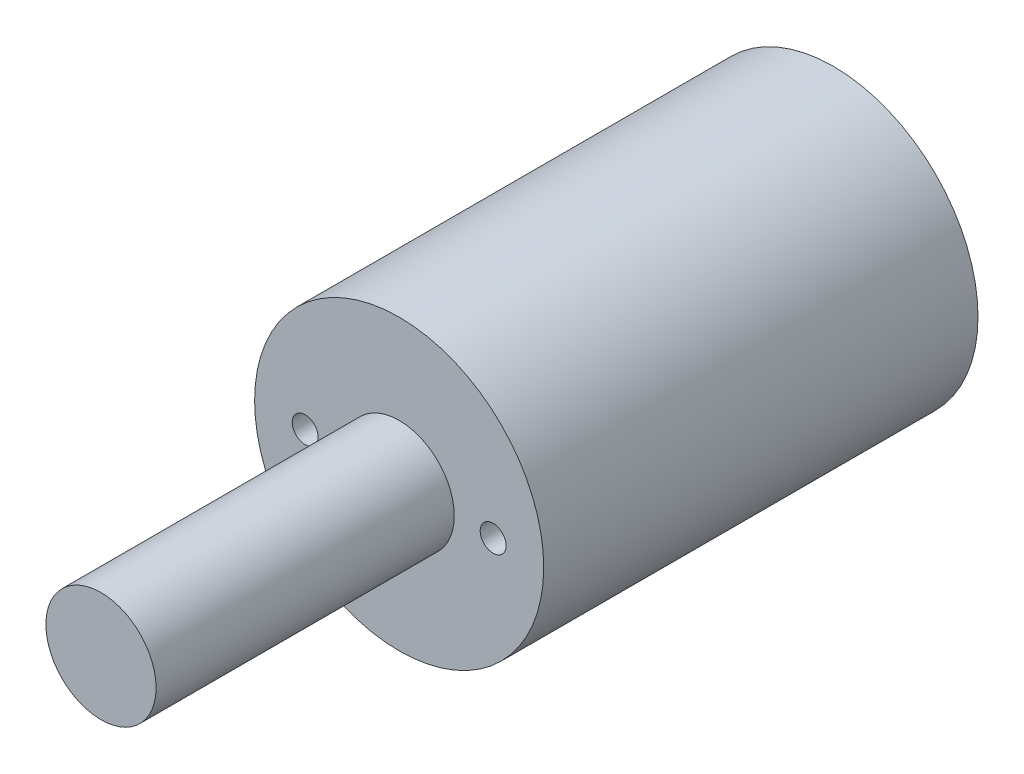
from build123d import *

# Parameters (mm, degrees)
SKETCH_1_R          = 22.3
EXTRUDE_1_DEPTH     = 67
SKETCH_2_R          = 8.5
EXTRUDE_2_DEPTH     = 46
SKETCH_3_R          = 2.5
EXTRUDE_3_DEPTH     = 7
SKETCH_4_R          = 2
CUT_EXTRUDE_1_DEPTH = 10


with BuildPart() as part:
    # 草圖1 → 填料-伸長1 (new body)
    with BuildSketch(Plane.XY):
        Circle(SKETCH_1_R)
    extrude(amount=EXTRUDE_1_DEPTH)

    # 草圖2 → 填料-伸長2 (add)
    with BuildSketch(Plane.XY.offset(67)):
        Circle(SKETCH_2_R)
    extrude(amount=EXTRUDE_2_DEPTH)

    # 草圖3 → 填料-伸長3 (add)
    with BuildSketch(Plane(origin=(0, 0, 0), x_dir=(-1, 0, 0), z_dir=(0, 0, -1))):
        with Locations(Location((0, 0, 0), (0, 0, 180))):
            Circle(SKETCH_3_R)
    extrude(amount=EXTRUDE_3_DEPTH)

    # 草圖4 → 除料-伸長1 (cut)
    with BuildSketch(Plane.XY.offset(67)):
        with Locations((14.5, 0)):
            Circle(SKETCH_4_R)
        with Locations(Location((-14.5, 0, 0), (0, 0, 180))):
            Circle(SKETCH_4_R)
    extrude(amount=-CUT_EXTRUDE_1_DEPTH, mode=Mode.SUBTRACT)


solid = part.part
